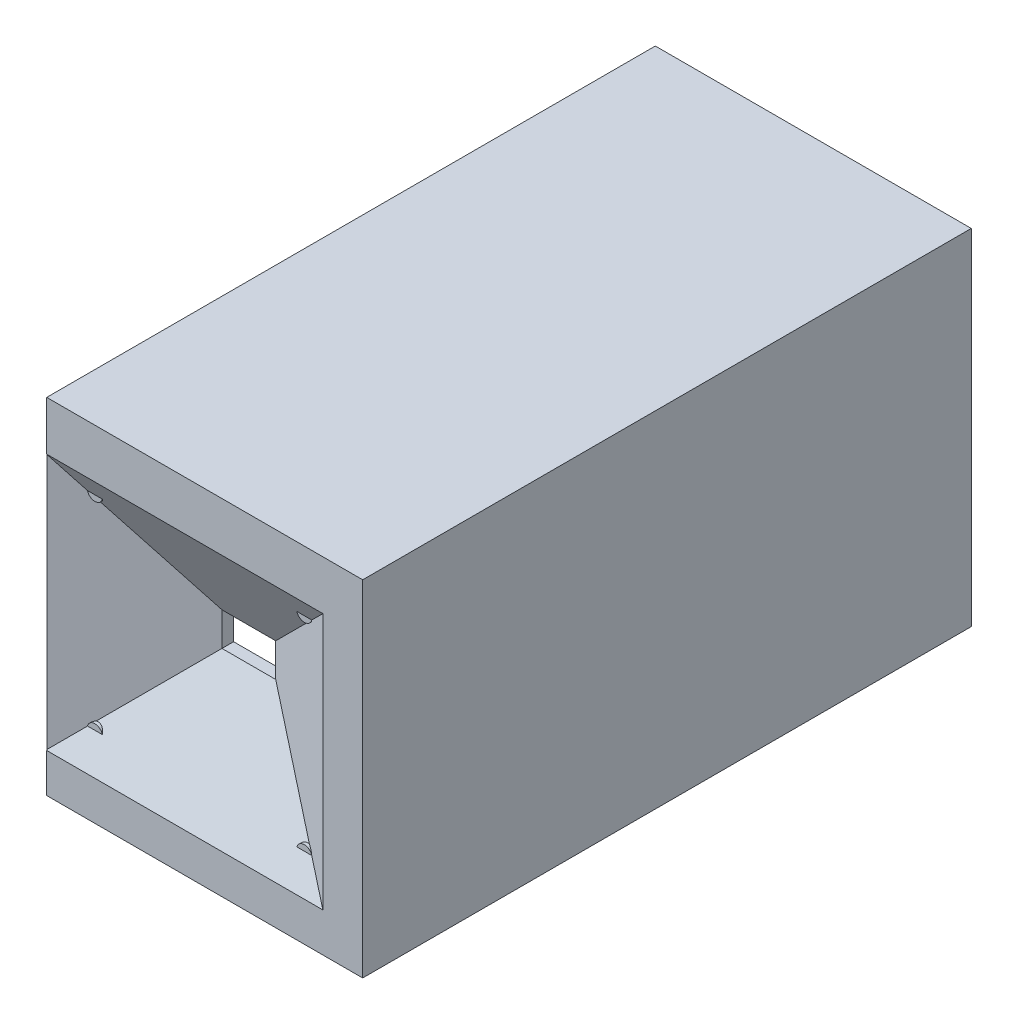
from build123d import *

# Parameters (mm, degrees)
SKETCH2_W           = 33.15
SKETCH2_H           = 33
BOSS_EXTRUDE1_DEPTH = 7.5
SKETCH3_R           = 0.762
CUT_EXTRUDE1_DEPTH  = 6
SKETCH4_W           = 5.3
SKETCH4_H           = 7
CUT_EXTRUDE2_DEPTH  = 3.4
SKETCH5_W           = 17.312690108
SKETCH5_H           = 1.808425299
CUT_EXTRUDE3_DEPTH  = 2
SKETCH6_W           = 5.3
SKETCH6_H           = 3.3
CUT_EXTRUDE4_DEPTH  = 25.560753755
CHAMFER3_SIZE       = 11
CHAMFER3_SIZE2      = 6.350852961
BOSS_EXTRUDE2_DEPTH = 52.5
SKETCH8_W           = 33.15
SKETCH8_H           = 60
BOSS_EXTRUDE3_DEPTH = 1
SKETCH9_W           = 3
SKETCH9_H           = 34
CUT_EXTRUDE5_DEPTH  = 60
SKETCH10_R          = 0.762
CUT_EXTRUDE6_DEPTH  = 6
SKETCH11_R          = 0.762
CUT_EXTRUDE7_DEPTH  = 6
SKETCH12_R          = 0.762
CUT_EXTRUDE9_DEPTH  = 7
SKETCH13_W          = 3
SKETCH13_H          = 5
CUT_EXTRUDE10_DEPTH = 1.5
SKETCH14_W          = 52.5
SKETCH14_H          = 1
BOSS_EXTRUDE4_DEPTH = 1
SKETCH15_R          = 0.762
CUT_EXTRUDE11_DEPTH = 3.5


with BuildPart() as part:
    # Sketch2 → Boss-Extrude1 (new body)
    with BuildSketch(Plane.XY):
        Rectangle(SKETCH2_W, SKETCH2_H)
    extrude(amount=BOSS_EXTRUDE1_DEPTH)

    # Sketch3 → Cut-Extrude1 (cut)
    with BuildSketch(Plane.XY):
        with Locations((10.325, 10.25)):
            Circle(SKETCH3_R)
        with Locations((-10.325, 10.25)):
            Circle(SKETCH3_R)
        with Locations((10.325, -10.25)):
            Circle(SKETCH3_R)
        with Locations((-10.325, -10.25)):
            Circle(SKETCH3_R)
    extrude(amount=CUT_EXTRUDE1_DEPTH, mode=Mode.SUBTRACT)

    # Sketch4 → Cut-Extrude2 (cut)
    with BuildSketch(Plane.XY):
        with Locations((9.775, 0)):
            Rectangle(SKETCH4_W, SKETCH4_H)
        with Locations((-9.775, 0)):
            Rectangle(SKETCH4_W, SKETCH4_H)
    extrude(amount=CUT_EXTRUDE2_DEPTH, mode=Mode.SUBTRACT)

    # Sketch5 → Cut-Extrude3 (cut)
    with BuildSketch(Plane.XY):
        with Locations((-0.109621432, -11.80915301)):
            Rectangle(SKETCH5_W, SKETCH5_H)
    extrude(amount=CUT_EXTRUDE3_DEPTH, mode=Mode.SUBTRACT)

    # Sketch6 → Cut-Extrude4 (cut, through all)
    with BuildSketch(Plane.XY):
        Rectangle(SKETCH6_W, SKETCH6_H)
    extrude(amount=CUT_EXTRUDE4_DEPTH, mode=Mode.SUBTRACT)

    # Chamfer3
    chamfer3_edges = [part.edges().sort_by_distance(p)[0] for p in [
        (2.65, 0, 7.5),
        (0, 1.65, 7.5),
        (-2.65, 0, 7.5),
        (0, -1.65, 7.5),
    ]]
    chamfer3_side = [part.faces().sort_by_distance(p)[0] for p in [
        (-16.107247662, 0, 7.5),
    ]]
    chamfer(chamfer3_edges, length=CHAMFER3_SIZE, length2=CHAMFER3_SIZE2, reference=chamfer3_side[0])

    # Sketch7 → Boss-Extrude2 (add)
    with BuildSketch(Plane.XY):
        Polygon((13.575, -16.5), (17.575, -16.5), (17.575, 16.5), (-16.575, 16.5), (-16.575, -16.5), (-13.575, -16.5), (-13.575, 13.5), (13.575, 13.5), align=None)
    extrude(amount=-BOSS_EXTRUDE2_DEPTH)

    # Sketch8 → Boss-Extrude3 (add)
    with BuildSketch(Plane(origin=(0, 16.5, 0), x_dir=(1, 0, 0), z_dir=(0, 1, 0))):
        with Locations((0, 22.5)):
            Rectangle(SKETCH8_W, SKETCH8_H)
    extrude(amount=BOSS_EXTRUDE3_DEPTH)

    # Sketch9 → Cut-Extrude5 (cut)
    with BuildSketch(Plane(origin=(0, 0, -52.5), x_dir=(-1, 0, 0), z_dir=(0, 0, -1))):
        with Locations((15.075, 0.5)):
            Rectangle(SKETCH9_W, SKETCH9_H)
    extrude(amount=-CUT_EXTRUDE5_DEPTH, mode=Mode.SUBTRACT)

    # Sketch10 → Cut-Extrude6 (cut)
    with BuildSketch(Plane.ZY.offset(13.575)):
        with Locations((-44, 15.5)):
            Circle(SKETCH10_R)
        with Locations(Location((5, 11, 0), (0, 0, 180))):
            Circle(SKETCH10_R)
        with Locations((5, -10)):
            Circle(SKETCH10_R)
    extrude(amount=-CUT_EXTRUDE6_DEPTH, mode=Mode.SUBTRACT)

    # Sketch11 → Cut-Extrude7 (cut)
    with BuildSketch(Plane(origin=(0, -16.5, 0), x_dir=(-1, 0, 0), z_dir=(0, -1, 0))):
        with Locations(Location((-15.575, 44, 0), (0, 0, 90))):
            Circle(SKETCH11_R)
        with Locations((-15.575, -51.5)):
            Circle(SKETCH11_R)
        with Locations(Location((7.075, -4.5, 0), (0, 0, 90))):
            Circle(SKETCH11_R)
        with Locations(Location((-11.075, -4.5, 0), (0, 0, 90))):
            Circle(SKETCH11_R)
    extrude(amount=-CUT_EXTRUDE7_DEPTH, mode=Mode.SUBTRACT)

    # Sketch12 → Cut-Extrude9 (cut)
    with BuildSketch(Plane(origin=(0, 0, -52.5), x_dir=(-1, 0, 0), z_dir=(0, 0, -1))):
        with Locations((-15.575, 15.5)):
            Circle(SKETCH12_R)
        with Locations((-15.575, -14.5)):
            Circle(SKETCH12_R)
        with Locations((11.575, 15.5)):
            Circle(SKETCH12_R)
    extrude(amount=-CUT_EXTRUDE9_DEPTH, mode=Mode.SUBTRACT)

    # Sketch13 → Cut-Extrude10 (cut)
    with BuildSketch(Plane.ZY.offset(-13.575)):
        Polygon((-46.5, 7), (-52.5, 7), (-52.5, -13), (-46.5, -13), (-46.5, -8), align=None)
        with Locations((-45, -10.5)):
            Rectangle(SKETCH13_W, SKETCH13_H)
    extrude(amount=-CUT_EXTRUDE10_DEPTH, mode=Mode.SUBTRACT)

    # Sketch14 → Boss-Extrude4 (add)
    with BuildSketch(Plane(origin=(16.575, 0, 0), x_dir=(0, 0, -1), z_dir=(1, 0, 0))):
        Polygon((0, 17.5), (-7.5, 17.5), (-7.5, -16.5), (0, -16.5), (0, 16.5), align=None)
        with Locations((26.25, 17)):
            Rectangle(SKETCH14_W, SKETCH14_H)
    extrude(amount=BOSS_EXTRUDE4_DEPTH)

    # Sketch15 → Cut-Extrude11 (cut)
    with BuildSketch(Plane.XZ.offset(-13.5)):
        with Locations(Location((-10.813, -7.538, 0), (0, 0, 270))):
            Circle(SKETCH15_R)
        with Locations(Location((10.677, -22.458, 0), (0, 0, 270))):
            Circle(SKETCH15_R)
    extrude(amount=-CUT_EXTRUDE11_DEPTH, mode=Mode.SUBTRACT)


solid = part.part
